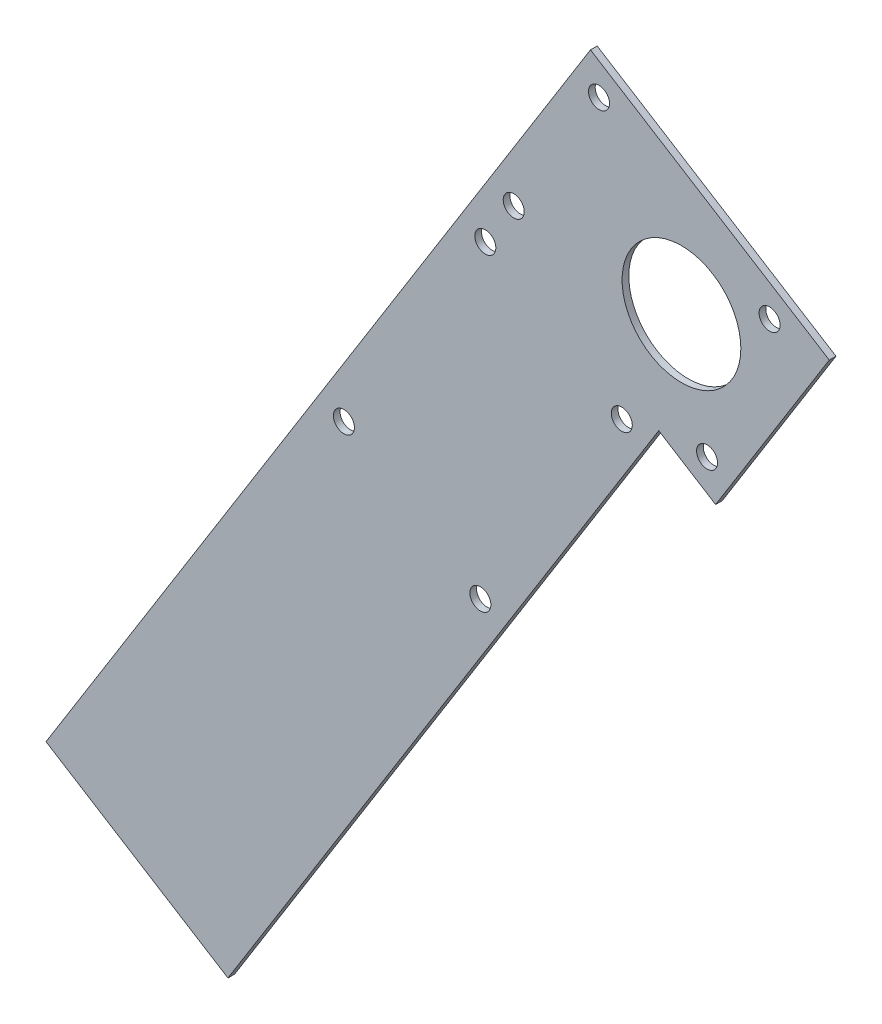
from build123d import *

# Parameters (mm, degrees)
BOSS_EXTRUDE1_DEPTH    = 1.5875
F_10_CLEARANCE_HOLE1_D = 4.9784
SKETCH5_R              = 14.057169334
CUT_EXTRUDE1_DEPTH     = 2.54


with BuildPart() as part:
    # Sketch2 → Boss-Extrude1 (new body)
    with BuildSketch(Plane(origin=(0, 0, 375.973880443), x_dir=(-1, 0, 0), z_dir=(0, 0, -1))):
        Polygon((-54.523488721, -26.582274219), (-27.603590087, -69.663117497), (-14.140826563, -61.250649173), (87.851311274, -224.47218895), (130.932154551, -197.552290315), (2.020118081, 8.750092739), align=None)
    extrude(amount=BOSS_EXTRUDE1_DEPTH)

    # #10 Clearance Hole1 (through all)
    with Locations(Plane(origin=(0, 0, 374.386380443), x_dir=(-1, 0, 0), z_dir=(0, 0, -1))):
        with Locations((-5.390733824, -63.270767254), (-25.583472007, -60.913024757), (-40.388290572, -25.23740497), (0, 0), (20.189923976, -32.310632459), (26.919898634, -43.080843278), (60.403864812, -96.66639049), (28.093232354, -116.856314466)):
            Hole(F_10_CLEARANCE_HOLE1_D / 2)

    # Sketch5 → Cut-Extrude1 (cut)
    with BuildSketch(Plane.XY.offset(375.973880443)):
        with Locations((19.523118196, -34.66274681)):
            Circle(SKETCH5_R)
    extrude(amount=-CUT_EXTRUDE1_DEPTH, mode=Mode.SUBTRACT)


solid = part.part
